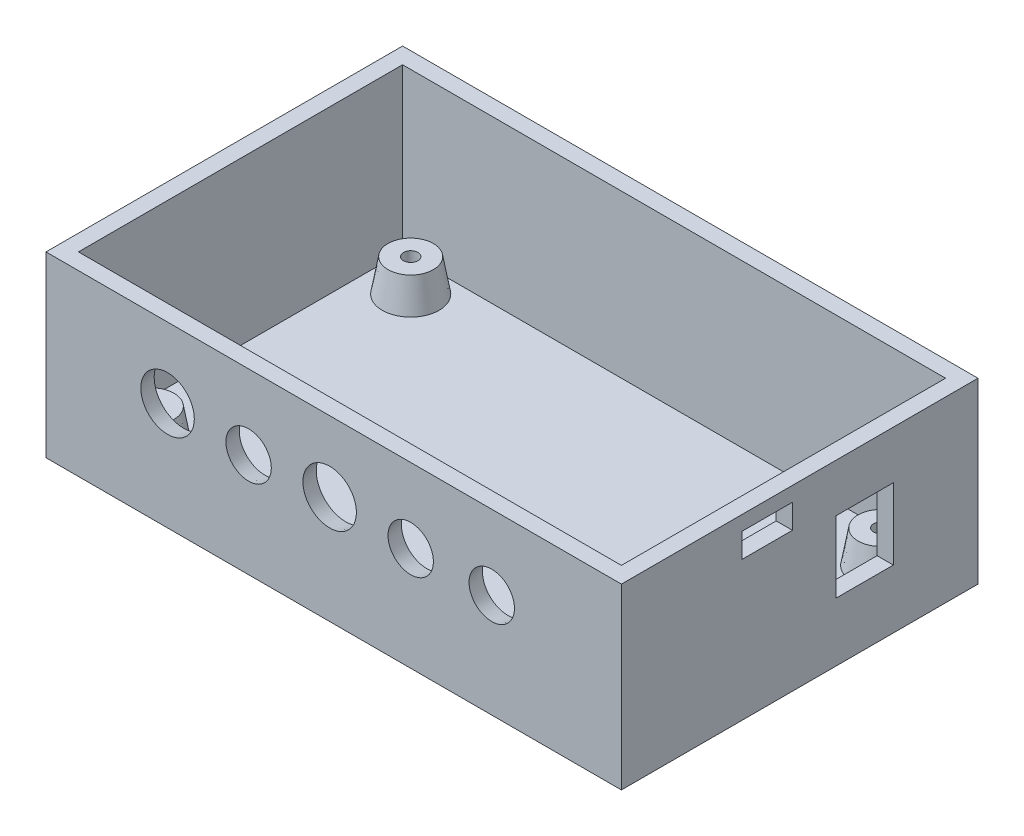
from build123d import *

# Parameters (mm, degrees)
SKETCH1_W                     = 90.17
SKETCH1_H                     = 55.88
BOSS_EXTRUDE1_DEPTH           = 27.94
SHELL1_T                      = -2.54
SKETCH2_R                     = 4.445
BOSS_EXTRUDE4_DEPTH           = 5.08
BOSS_EXTRUDE4_DRAFT           = 10
BOSS_EXTRUDE4_PROFILE_2_DEPTH = 5.08
BOSS_EXTRUDE4_PROFILE_2_DRAFT = 10
BOSS_EXTRUDE4_PROFILE_3_DEPTH = 5.08
BOSS_EXTRUDE4_PROFILE_3_DRAFT = 10
BOSS_EXTRUDE4_PROFILE_4_DEPTH = 5.08
BOSS_EXTRUDE4_PROFILE_4_DRAFT = 10
TAP_DRILL_FOR_4_40_TAP1_D     = 2.2606
TAP_DRILL_FOR_4_40_TAP1_DEPTH = 6.35
TAP_DRILL_FOR_4_40_TAP1_TIP   = 0.679152758
SKETCH6_R                     = 3.556
CUT_EXTRUDE1_DEPTH            = 2.54
CUT_EXTRUDE1_DRAFT            = 10
CUT_EXTRUDE1_PROFILE_2_DEPTH  = 2.54
CUT_EXTRUDE1_PROFILE_2_DRAFT  = 10
CUT_EXTRUDE1_PROFILE_3_DEPTH  = 2.54
CUT_EXTRUDE1_PROFILE_3_DRAFT  = 10
SKETCH6_R_2                   = 4.191
CUT_EXTRUDE1_PROFILE_4_DEPTH  = 2.54
CUT_EXTRUDE1_PROFILE_4_DRAFT  = 10
CUT_EXTRUDE1_PROFILE_5_DEPTH  = 2.54
CUT_EXTRUDE1_PROFILE_5_DRAFT  = 10
CUT_EXTRUDE2_REACH            = 100.448
SKETCH7_W                     = 9.017
SKETCH7_H                     = 11.176
SKETCH7_W_2                   = 7.874
SKETCH7_H_2                   = 3.81


with BuildPart() as part:
    # Sketch1 → Boss-Extrude1 (new body)
    with BuildSketch(Plane(origin=(0, 0, 0), x_dir=(1, 0, 0), z_dir=(0, 1, 0))):
        Rectangle(SKETCH1_W, SKETCH1_H)
    extrude(amount=BOSS_EXTRUDE1_DEPTH)

    # Shell1
    shell1_openings = [part.faces().sort_by_distance(p)[0] for p in [
        (0, 27.94, 0),
    ]]
    offset(amount=SHELL1_T, openings=shell1_openings, kind=Kind.INTERSECTION)


with BuildPart() as boss_extrude4_tool:
    # Sketch2 → Boss-Extrude4 (with draft: the straight prism first)
    with BuildSketch(Plane(origin=(0, 2.54, 0), x_dir=(1, 0, 0), z_dir=(0, 1, 0))):
        with Locations((37.465, 20.32)):
            Circle(SKETCH2_R)
    extrude(amount=BOSS_EXTRUDE4_DEPTH)
    # Boss-Extrude4: the draft: its side faces are tilted about the plane it starts from
    boss_extrude4_sides = [boss_extrude4_tool.faces().sort_by_distance(p)[0] for p in [
        (33.02, 5.08, -20.32),
    ]]
    draft(boss_extrude4_sides, Plane(origin=(0, 2.54, 0), x_dir=(1, 0, 0), z_dir=(0, 1, 0)), BOSS_EXTRUDE4_DRAFT)


with BuildPart() as part_1:
    add(part.part)

    # Boss-Extrude4: add boss_extrude4_tool
    add(boss_extrude4_tool.part)


with BuildPart() as boss_extrude4_profile_2_tool:
    # Sketch2 → Boss-Extrude4 profile 2 (with draft: the straight prism first)
    with BuildSketch(Plane(origin=(0, 2.54, 0), x_dir=(1, 0, 0), z_dir=(0, 1, 0))):
        with Locations((37.465, -20.32)):
            Circle(SKETCH2_R)
    extrude(amount=BOSS_EXTRUDE4_PROFILE_2_DEPTH)
    # Boss-Extrude4 profile 2: the draft: its side faces are tilted about the plane it starts from
    boss_extrude4_profile_2_sides = [boss_extrude4_profile_2_tool.faces().sort_by_distance(p)[0] for p in [
        (33.02, 5.08, 20.32),
    ]]
    draft(boss_extrude4_profile_2_sides, Plane(origin=(0, 2.54, 0), x_dir=(1, 0, 0), z_dir=(0, 1, 0)), BOSS_EXTRUDE4_PROFILE_2_DRAFT)


with BuildPart() as part_2:
    add(part_1.part)

    # Boss-Extrude4 profile 2: add boss_extrude4_profile_2_tool
    add(boss_extrude4_profile_2_tool.part)


with BuildPart() as boss_extrude4_profile_3_tool:
    # Sketch2 → Boss-Extrude4 profile 3 (with draft: the straight prism first)
    with BuildSketch(Plane(origin=(0, 2.54, 0), x_dir=(1, 0, 0), z_dir=(0, 1, 0))):
        with Locations((-36.195, -20.32)):
            Circle(SKETCH2_R)
    extrude(amount=BOSS_EXTRUDE4_PROFILE_3_DEPTH)
    # Boss-Extrude4 profile 3: the draft: its side faces are tilted about the plane it starts from
    boss_extrude4_profile_3_sides = [boss_extrude4_profile_3_tool.faces().sort_by_distance(p)[0] for p in [
        (-40.64, 5.08, 20.32),
    ]]
    draft(boss_extrude4_profile_3_sides, Plane(origin=(0, 2.54, 0), x_dir=(1, 0, 0), z_dir=(0, 1, 0)), BOSS_EXTRUDE4_PROFILE_3_DRAFT)


with BuildPart() as part_3:
    add(part_2.part)

    # Boss-Extrude4 profile 3: add boss_extrude4_profile_3_tool
    add(boss_extrude4_profile_3_tool.part)


with BuildPart() as boss_extrude4_profile_4_tool:
    # Sketch2 → Boss-Extrude4 profile 4 (with draft: the straight prism first)
    with BuildSketch(Plane(origin=(0, 2.54, 0), x_dir=(1, 0, 0), z_dir=(0, 1, 0))):
        with Locations((-36.195, 20.32)):
            Circle(SKETCH2_R)
    extrude(amount=BOSS_EXTRUDE4_PROFILE_4_DEPTH)
    # Boss-Extrude4 profile 4: the draft: its side faces are tilted about the plane it starts from
    boss_extrude4_profile_4_sides = [boss_extrude4_profile_4_tool.faces().sort_by_distance(p)[0] for p in [
        (-40.64, 5.08, -20.32),
    ]]
    draft(boss_extrude4_profile_4_sides, Plane(origin=(0, 2.54, 0), x_dir=(1, 0, 0), z_dir=(0, 1, 0)), BOSS_EXTRUDE4_PROFILE_4_DRAFT)


with BuildPart() as part_4:
    add(part_3.part)

    # Boss-Extrude4 profile 4: add boss_extrude4_profile_4_tool
    add(boss_extrude4_profile_4_tool.part)

    # Tap Drill for #4-40 Tap1
    with Locations(Plane(origin=(0, 7.62, 0), x_dir=(1, 0, 0), z_dir=(0, 1, 0))):
        with Locations((-36.195, 20.32), (-36.195, -20.32), (37.465, -20.32), (37.465, 20.32)):
            Hole(TAP_DRILL_FOR_4_40_TAP1_D / 2, depth=TAP_DRILL_FOR_4_40_TAP1_DEPTH)
            with Locations((0, 0, -(TAP_DRILL_FOR_4_40_TAP1_DEPTH + TAP_DRILL_FOR_4_40_TAP1_TIP / 2))):  # 118° drill point
                Cone(0, TAP_DRILL_FOR_4_40_TAP1_D / 2, TAP_DRILL_FOR_4_40_TAP1_TIP, mode=Mode.SUBTRACT)


with BuildPart() as cut_extrude1_tool:
    # Sketch6 → Cut-Extrude1 (with draft: the straight prism first)
    with BuildSketch(Plane.XY.offset(27.94)):
        with Locations((24.765, 16.256)):
            Circle(SKETCH6_R)
    extrude(amount=-CUT_EXTRUDE1_DEPTH)
    # Cut-Extrude1: the draft: its side faces are tilted about the plane it starts from
    cut_extrude1_sides = [cut_extrude1_tool.faces().sort_by_distance(p)[0] for p in [
        (21.209, 16.256, 26.67),
    ]]
    draft(cut_extrude1_sides, Plane.XY.offset(27.94), CUT_EXTRUDE1_DRAFT)


with BuildPart() as part_5:
    add(part_4.part)

    # Cut-Extrude1: cut by cut_extrude1_tool
    add(cut_extrude1_tool.part, mode=Mode.SUBTRACT)


with BuildPart() as cut_extrude1_profile_2_tool:
    # Sketch6 → Cut-Extrude1 profile 2 (with draft: the straight prism first)
    with BuildSketch(Plane.XY.offset(27.94)):
        with Locations((12.065, 16.256)):
            Circle(SKETCH6_R)
    extrude(amount=-CUT_EXTRUDE1_PROFILE_2_DEPTH)
    # Cut-Extrude1 profile 2: the draft: its side faces are tilted about the plane it starts from
    cut_extrude1_profile_2_sides = [cut_extrude1_profile_2_tool.faces().sort_by_distance(p)[0] for p in [
        (8.509, 16.256, 26.67),
    ]]
    draft(cut_extrude1_profile_2_sides, Plane.XY.offset(27.94), CUT_EXTRUDE1_PROFILE_2_DRAFT)


with BuildPart() as part_6:
    add(part_5.part)

    # Cut-Extrude1 profile 2: cut by cut_extrude1_profile_2_tool
    add(cut_extrude1_profile_2_tool.part, mode=Mode.SUBTRACT)


with BuildPart() as cut_extrude1_profile_3_tool:
    # Sketch6 → Cut-Extrude1 profile 3 (with draft: the straight prism first)
    with BuildSketch(Plane.XY.offset(27.94)):
        with Locations((-13.335, 16.256)):
            Circle(SKETCH6_R)
    extrude(amount=-CUT_EXTRUDE1_PROFILE_3_DEPTH)
    # Cut-Extrude1 profile 3: the draft: its side faces are tilted about the plane it starts from
    cut_extrude1_profile_3_sides = [cut_extrude1_profile_3_tool.faces().sort_by_distance(p)[0] for p in [
        (-16.891, 16.256, 26.67),
    ]]
    draft(cut_extrude1_profile_3_sides, Plane.XY.offset(27.94), CUT_EXTRUDE1_PROFILE_3_DRAFT)


with BuildPart() as part_7:
    add(part_6.part)

    # Cut-Extrude1 profile 3: cut by cut_extrude1_profile_3_tool
    add(cut_extrude1_profile_3_tool.part, mode=Mode.SUBTRACT)


with BuildPart() as cut_extrude1_profile_4_tool:
    # Sketch6 → Cut-Extrude1 profile 4 (with draft: the straight prism first)
    with BuildSketch(Plane.XY.offset(27.94)):
        with Locations((-0.635, 16.891)):
            Circle(SKETCH6_R_2)
    extrude(amount=-CUT_EXTRUDE1_PROFILE_4_DEPTH)
    # Cut-Extrude1 profile 4: the draft: its side faces are tilted about the plane it starts from
    cut_extrude1_profile_4_sides = [cut_extrude1_profile_4_tool.faces().sort_by_distance(p)[0] for p in [
        (-4.826, 16.891, 26.67),
    ]]
    draft(cut_extrude1_profile_4_sides, Plane.XY.offset(27.94), CUT_EXTRUDE1_PROFILE_4_DRAFT)


with BuildPart() as part_8:
    add(part_7.part)

    # Cut-Extrude1 profile 4: cut by cut_extrude1_profile_4_tool
    add(cut_extrude1_profile_4_tool.part, mode=Mode.SUBTRACT)


with BuildPart() as cut_extrude1_profile_5_tool:
    # Sketch6 → Cut-Extrude1 profile 5 (with draft: the straight prism first)
    with BuildSketch(Plane.XY.offset(27.94)):
        with Locations((-26.035, 16.891)):
            Circle(SKETCH6_R_2)
    extrude(amount=-CUT_EXTRUDE1_PROFILE_5_DEPTH)
    # Cut-Extrude1 profile 5: the draft: its side faces are tilted about the plane it starts from
    cut_extrude1_profile_5_sides = [cut_extrude1_profile_5_tool.faces().sort_by_distance(p)[0] for p in [
        (-30.226, 16.891, 26.67),
    ]]
    draft(cut_extrude1_profile_5_sides, Plane.XY.offset(27.94), CUT_EXTRUDE1_PROFILE_5_DRAFT)


with BuildPart() as part_9:
    add(part_8.part)

    # Cut-Extrude1 profile 5: cut by cut_extrude1_profile_5_tool
    add(cut_extrude1_profile_5_tool.part, mode=Mode.SUBTRACT)

    # Sketch7 → Cut-Extrude2 (cut, up to next)
    with BuildSketch(Plane(origin=(45.085, 0, 0), x_dir=(0, 0, -1), z_dir=(1, 0, 0)), mode=Mode.PRIVATE) as cut_extrude2_sk1:
        with Locations((10.16, 14.8082)):
            Rectangle(SKETCH7_W, SKETCH7_H)
    cut_extrude2_tool1 = extrude(cut_extrude2_sk1.sketch, amount=-CUT_EXTRUDE2_REACH, mode=Mode.PRIVATE) & part_9.part
    # Sketch7 → Cut-Extrude2 (cut, up to next)
    with BuildSketch(Plane(origin=(45.085, 0, 0), x_dir=(0, 0, -1), z_dir=(1, 0, 0)), mode=Mode.PRIVATE) as cut_extrude2_sk2:
        with Locations((-5.08, 23.749)):
            Rectangle(SKETCH7_W_2, SKETCH7_H_2)
    cut_extrude2_tool2 = extrude(cut_extrude2_sk2.sketch, amount=-CUT_EXTRUDE2_REACH, mode=Mode.PRIVATE) & part_9.part
    add(cut_extrude2_tool1.solids().sort_by_distance((45.085, 14.8082, -10.16))[0], mode=Mode.SUBTRACT)
    add(cut_extrude2_tool2.solids().sort_by_distance((45.085, 23.749, 5.08))[0], mode=Mode.SUBTRACT)


solid = part_9.part
